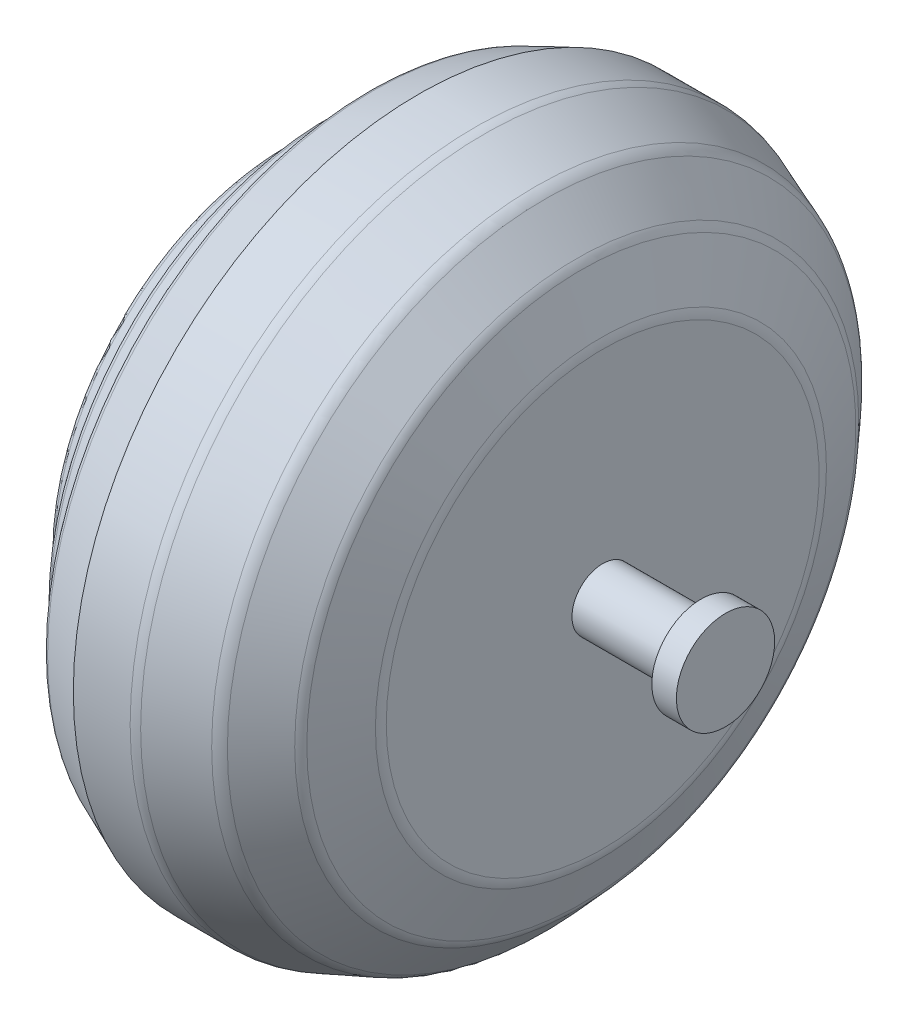
from build123d import *

# Parameters (mm, degrees)
REDONDEO3_R             = 5
CROQUIS2_R              = 12.5
SALIENTE_EXTRUIR1_DEPTH = 40
CROQUIS3_R              = 20
SALIENTE_EXTRUIR2_DEPTH = 10


with BuildPart() as part:
    # Croquis1 → Revolución1 (revolve)
    with BuildSketch(Plane(origin=(0, 0, 0), x_dir=(1, 0, 0), z_dir=(0, 1, 0))):
        with BuildLine():
            Line((93.136469217, 140.438586249), (70, 140.438586249))
            Line((70, 140.438586249), (48.737618848, 131.388343039))
            Line((48.737618848, 131.388343039), (48.737618848, 120.610275725))
            Line((48.737618848, 120.610275725), (31.868809424, 113.430137863))
            Line((31.868809424, 113.430137863), (31.868809424, 102.180137863))
            Line((31.868809424, 102.180137863), (15, 95))
            Line((15, 95), (15, 0))
            Line((15, 0), (70, 0))
            Line((70, 0), (145, 0))
            Line((145, 0), (145, 88.080438356))
            ThreePointArc((145, 88.080438356), (144.820704123, 89.965583051), (144.289245896, 91.783128012))
            Line((144.289245896, 91.783128012), (136.332769552, 111.744202824))
            ThreePointArc((136.332769552, 111.744202824), (135.522244312, 113.34352185), (134.43914749, 114.772393358))
            Line((134.43914749, 114.772393358), (121.382088175, 129.118971571))
            ThreePointArc((121.382088175, 129.118971571), (119.636600305, 130.638907317), (117.588438461, 131.716852417))
            Line((117.588438461, 131.716852417), (96.738443336, 139.767347284))
            ThreePointArc((96.738443336, 139.767347284), (94.968461254, 140.269344367), (93.136469217, 140.438586249))
        make_face()
    revolve(axis=Axis((-209.218950064, 0, 0), (1, 0, 0)))

    # Redondeo3
    redondeo3_edges = [part.edges().sort_by_distance(p)[0] for p in [
        (15, 0, 95),
        (31.868809424, 0, 102.180137863),
        (31.868809424, 0, 113.430137863),
        (48.737618848, 0, 120.610275725),
        (48.737618848, 0, 131.388343039),
    ]]
    fillet(redondeo3_edges, radius=REDONDEO3_R)

    # Croquis2 → Saliente-Extruir1 (add)
    with BuildSketch(Plane(origin=(145, 0, 0), x_dir=(0, 0, -1), z_dir=(1, 0, 0))):
        Circle(CROQUIS2_R)
    extrude(amount=SALIENTE_EXTRUIR1_DEPTH)

    # Croquis3 → Saliente-Extruir2 (add)
    with BuildSketch(Plane(origin=(185, 0, 0), x_dir=(0, 0, -1), z_dir=(1, 0, 0))):
        Circle(CROQUIS3_R)
    extrude(amount=SALIENTE_EXTRUIR2_DEPTH)


solid = part.part
